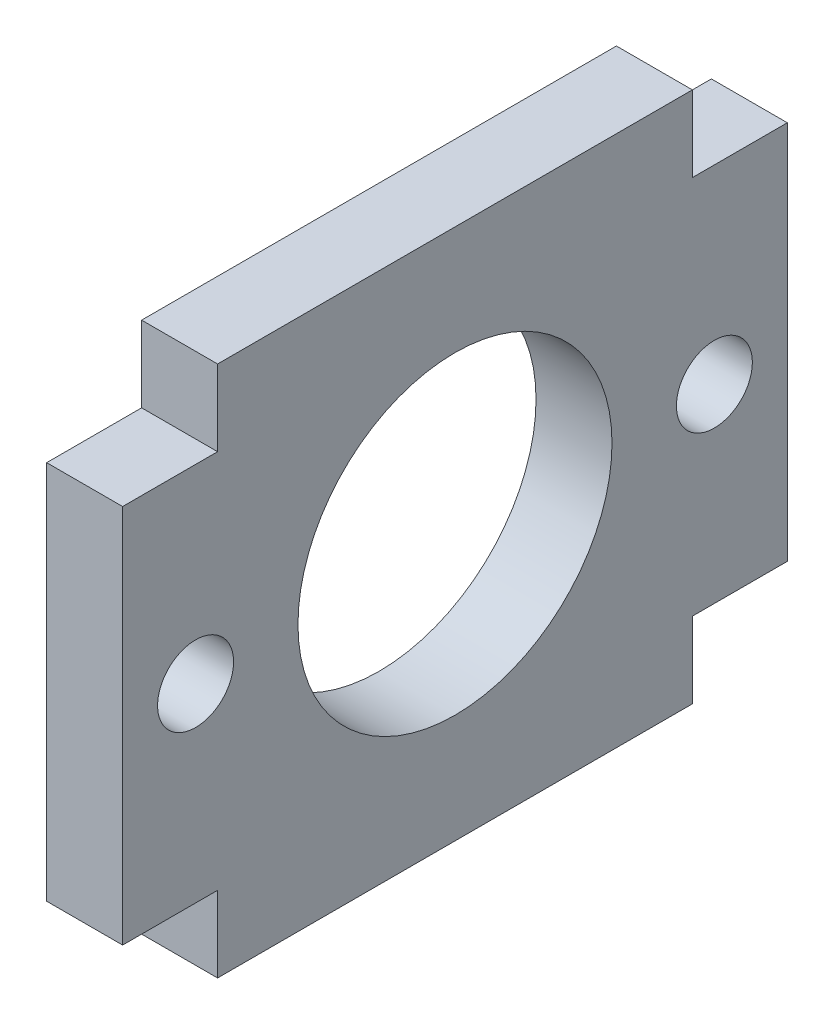
from build123d import *

# Parameters (mm, degrees)
SKETCH1_R           = 10.499999955
SKETCH1_R_2         = 2.54
BOSS_EXTRUDE1_DEPTH = 5.08


with BuildPart() as part:
    # Sketch1 → Boss-Extrude1 (new body)
    with BuildSketch(Plane(origin=(0, 0, 0), x_dir=(0, 0, -1), z_dir=(1, 0, 0))):
        Polygon((-15.875, 12.7), (-22.225, 12.7), (-22.225, -12.7), (-15.875, -12.7), (-15.875, -17.78), (15.875, -17.78), (15.875, -12.7), (22.225, -12.7), (22.225, 12.7), (15.875, 12.7), (15.875, 17.78), (-15.875, 17.78), align=None)
        Circle(SKETCH1_R, mode=Mode.SUBTRACT)
        with Locations((17.346281091, 0)):
            Circle(SKETCH1_R_2, mode=Mode.SUBTRACT)
        with Locations((-17.346281091, 0)):
            Circle(SKETCH1_R_2, mode=Mode.SUBTRACT)
    extrude(amount=BOSS_EXTRUDE1_DEPTH)


solid = part.part
